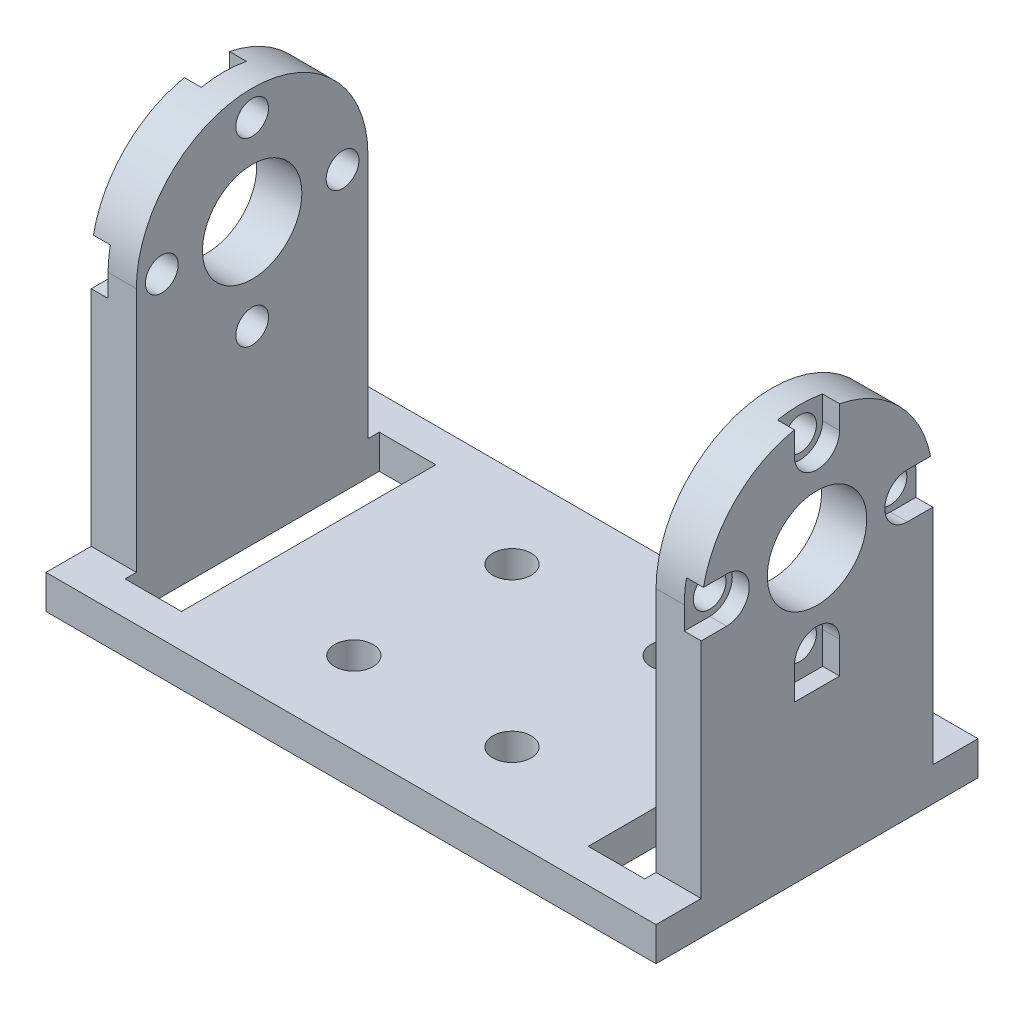
from build123d import *

# Parameters (mm, degrees)
SKETCH1_W           = 54
SKETCH1_H           = 28.5
SKETCH1_W_2         = 5
SKETCH1_H_2         = 22.5
SKETCH1_R           = 1.7
SKETCH1_R_2         = 7.5
BOSS_EXTRUDE2_DEPTH = 3
SKETCH2_W           = 4
SKETCH2_H           = 20.5
BOSS_EXTRUDE3_DEPTH = 21.75
SKETCH4_R           = 10.25
BOSS_EXTRUDE4_DEPTH = 4
SKETCH6_R           = 4.4
SKETCH6_R_2         = 1.45
CUT_EXTRUDE3_DEPTH  = 4
SKETCH7_R           = 1.45
CUT_EXTRUDE4_DEPTH  = 1.5
SKETCH8_W           = 28.781481152
SKETCH8_H           = 28.5
BOSS_EXTRUDE5_DEPTH = 3
SKETCH9_R           = 1.7
CUT_EXTRUDE5_DEPTH  = 3


with BuildPart() as part:
    # Sketch1 → Boss-Extrude2 (new body)
    with BuildSketch(Plane(origin=(0, 0, 0), x_dir=(1, 0, 0), z_dir=(0, 1, 0))):
        Rectangle(SKETCH1_W, SKETCH1_H)
        with Locations((20.5, 0)):
            Rectangle(SKETCH1_W_2, SKETCH1_H_2, mode=Mode.SUBTRACT)
        with Locations((-20.5, 0)):
            Rectangle(SKETCH1_W_2, SKETCH1_H_2, mode=Mode.SUBTRACT)
        with Locations(Location((-9, -8.25, 0), (0, 0, 270))):
            Circle(SKETCH1_R, mode=Mode.SUBTRACT)
        with Locations(Location((9, -8.25, 0), (0, 0, 270))):
            Circle(SKETCH1_R, mode=Mode.SUBTRACT)
        with Locations(Location((-9, 8.25, 0), (0, 0, 270))):
            Circle(SKETCH1_R, mode=Mode.SUBTRACT)
        with Locations(Location((0, 0, 0), (0, 0, 270))):
            Circle(SKETCH1_R_2, mode=Mode.SUBTRACT)
        with Locations(Location((9, 8.25, 0), (0, 0, 270))):
            Circle(SKETCH1_R, mode=Mode.SUBTRACT)
    extrude(amount=BOSS_EXTRUDE2_DEPTH)

    # Sketch2 → Boss-Extrude3 (add)
    with BuildSketch(Plane(origin=(0, 3, 0), x_dir=(1, 0, 0), z_dir=(0, 1, 0))):
        with Locations((25, 0)):
            Rectangle(SKETCH2_W, SKETCH2_H)
    boss_extrude3 = extrude(amount=BOSS_EXTRUDE3_DEPTH)

    # Sketch4 → Boss-Extrude4 (add)
    with BuildSketch(Plane(origin=(27, 0, 0), x_dir=(0, 0, -1), z_dir=(1, 0, 0))):
        with Locations((0, 24.75)):
            Circle(SKETCH4_R)
    boss_extrude4 = extrude(amount=-BOSS_EXTRUDE4_DEPTH)

    # Mirror1: Boss-Extrude3, Boss-Extrude4 across plane
    add(boss_extrude3.mirror(Plane(origin=(0, 0, 0), x_dir=(0, 0, 1), z_dir=(1, 0, 0))))
    add(boss_extrude4.mirror(Plane(origin=(0, 0, 0), x_dir=(0, 0, 1), z_dir=(1, 0, 0))))

    # Sketch6 → Cut-Extrude3 (cut)
    with BuildSketch(Plane(origin=(27, 0, 0), x_dir=(0, 0, -1), z_dir=(1, 0, 0))):
        with Locations((0, 24.75)):
            Circle(SKETCH6_R)
        with Locations((0, 32.75)):
            Circle(SKETCH6_R_2)
        with Locations((8, 24.75)):
            Circle(SKETCH6_R_2)
        with Locations((0, 16.75)):
            Circle(SKETCH6_R_2)
        with Locations((-8, 24.75)):
            Circle(SKETCH6_R_2)
    cut_extrude3 = extrude(amount=-CUT_EXTRUDE3_DEPTH, mode=Mode.SUBTRACT)

    # Mirror3: Cut-Extrude3 across plane
    add(cut_extrude3.mirror(Plane(origin=(0, 0, 0), x_dir=(0, 0, 1), z_dir=(1, 0, 0))), mode=Mode.SUBTRACT)

    # Sketch7 → Cut-Extrude4 (cut)
    # profile 1 of 4: a face of its own
    with BuildSketch(Plane(origin=(27, 0, 0), x_dir=(0, 0, -1), z_dir=(1, 0, 0))):
        with BuildLine():
            ThreePointArc((10.25, 24.75), (10.200627247, 25.754840168), (10.052984631, 26.75))
            Line((10.052984631, 26.75), (8, 26.75))
            ThreePointArc((8, 26.75), (6, 24.75), (8, 22.75))
            Line((8, 22.75), (10.25, 22.75))
            Line((10.25, 22.75), (10.25, 24.75))
        make_face()
        with Locations((8, 24.75)):
            Circle(SKETCH7_R, mode=Mode.SUBTRACT)
    # profile 2 of 4: a face of its own
    with BuildSketch(Plane(origin=(27, 0, 0), x_dir=(0, 0, -1), z_dir=(1, 0, 0))):
        with BuildLine():
            Line((2, 32.75), (2, 34.802984631))
            ThreePointArc((2, 34.802984631), (0, 35), (-2, 34.802984631))
            Line((-2, 34.802984631), (-2, 32.75))
            ThreePointArc((-2, 32.75), (0, 30.75), (2, 32.75))
        make_face()
        with Locations((0, 32.75)):
            Circle(SKETCH7_R, mode=Mode.SUBTRACT)
    # profile 3 of 4: a face of its own
    with BuildSketch(Plane(origin=(27, 0, 0), x_dir=(0, 0, -1), z_dir=(1, 0, 0))):
        with BuildLine():
            Line((-8, 26.75), (-10.052984631, 26.75))
            ThreePointArc((-10.052984631, 26.75), (-10.200627247, 25.754840168), (-10.25, 24.75))
            Line((-10.25, 24.75), (-10.25, 22.75))
            Line((-10.25, 22.75), (-8, 22.75))
            ThreePointArc((-8, 22.75), (-6, 24.75), (-8, 26.75))
        make_face()
        with Locations((-8, 24.75)):
            Circle(SKETCH7_R, mode=Mode.SUBTRACT)
    # profile 4 of 4: a face of its own
    with BuildSketch(Plane(origin=(27, 0, 0), x_dir=(0, 0, -1), z_dir=(1, 0, 0))):
        with BuildLine():
            Line((-2, 16.75), (-2, 13.927640071))
            Line((-2, 13.927640071), (2, 13.927640071))
            Line((2, 13.927640071), (2, 16.75))
            ThreePointArc((2, 16.75), (0, 18.75), (-2, 16.75))
        make_face()
        with Locations((0, 16.75)):
            Circle(SKETCH7_R, mode=Mode.SUBTRACT)
    cut_extrude4 = extrude(amount=-CUT_EXTRUDE4_DEPTH, mode=Mode.SUBTRACT)

    # Mirror4: Cut-Extrude4 across plane
    add(cut_extrude4.mirror(Plane(origin=(0, 0, 0), x_dir=(0, 0, 1), z_dir=(1, 0, 0))), mode=Mode.SUBTRACT)

    # Sketch8 → Boss-Extrude5 (add)
    with BuildSketch(Plane(origin=(0, 3, 0), x_dir=(1, 0, 0), z_dir=(0, 1, 0))):
        Rectangle(SKETCH8_W, SKETCH8_H)
    extrude(amount=-BOSS_EXTRUDE5_DEPTH)

    # Sketch9 → Cut-Extrude5 (cut)
    with BuildSketch(Plane(origin=(0, 3, 0), x_dir=(1, 0, 0), z_dir=(0, 1, 0))):
        with BuildLine():
            ThreePointArc((-5.3, -7), (-5.797918472, -5.797918472), (-7, -5.3))
            Line((-7, -5.3), (-7, -7))
            Line((-7, -7), (-5.3, -7))
        make_face()
        with BuildLine():
            Line((-7, -7), (-7, -5.3))
            ThreePointArc((-7, -5.3), (-8.202081528, -8.202081528), (-5.3, -7))
            Line((-5.3, -7), (-7, -7))
        make_face()
        with BuildLine():
            ThreePointArc((8.7, -7), (8.202081528, -5.797918472), (7, -5.3))
            Line((7, -5.3), (7, -7))
            Line((7, -7), (5.3, -7))
            ThreePointArc((5.3, -7), (7, -8.7), (8.7, -7))
        make_face()
        with BuildLine():
            Line((7, -7), (7, -5.3))
            ThreePointArc((7, -5.3), (5.797918472, -5.797918472), (5.3, -7))
            Line((5.3, -7), (7, -7))
        make_face()
        with BuildLine():
            ThreePointArc((8.7, 7), (7, 8.7), (5.3, 7))
            Line((5.3, 7), (7, 7))
            Line((7, 7), (7, 5.3))
            ThreePointArc((7, 5.3), (8.202081528, 5.797918472), (8.7, 7))
        make_face()
        with BuildLine():
            Line((7, 7), (5.3, 7))
            ThreePointArc((5.3, 7), (5.797918472, 5.797918472), (7, 5.3))
            Line((7, 5.3), (7, 7))
        make_face()
        with Locations(Location((-7, 7, 0), (0, 0, 270))):
            Circle(SKETCH9_R)
    extrude(amount=-CUT_EXTRUDE5_DEPTH, mode=Mode.SUBTRACT)


solid = part.part
